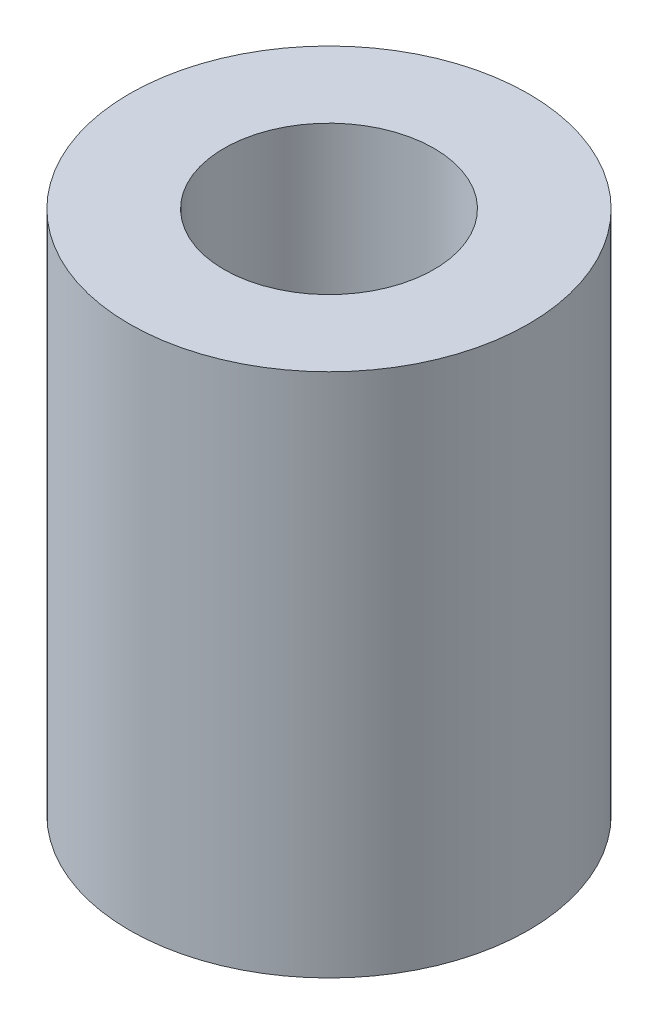
from build123d import *

# Parameters (mm, degrees)
SKETCH1_R           = 9.5
BOSS_EXTRUDE1_DEPTH = 25
SKETCH2_R           = 5
CUT_EXTRUDE1_DEPTH  = 20
SKETCH3_R           = 2
CUT_EXTRUDE2_DEPTH  = 29.381331893


with BuildPart() as part:
    # Sketch1 → Boss-Extrude1 (new body)
    with BuildSketch(Plane(origin=(0, 0, 0), x_dir=(1, 0, 0), z_dir=(0, 1, 0))):
        with Locations(Location((0, 0, 0), (0, 0, 270))):
            Circle(SKETCH1_R)
    extrude(amount=BOSS_EXTRUDE1_DEPTH)

    # Sketch2 → Cut-Extrude1 (cut)
    with BuildSketch(Plane(origin=(0, 25, 0), x_dir=(1, 0, 0), z_dir=(0, 1, 0))):
        with Locations(Location((0, 0, 0), (0, 0, 270))):
            Circle(SKETCH2_R)
    extrude(amount=-CUT_EXTRUDE1_DEPTH, mode=Mode.SUBTRACT)

    # Sketch3 → Cut-Extrude2 (cut, through all)
    with BuildSketch(Plane.XZ):
        with Locations(Location((0, 0, 0), (0, 0, 270))):
            Circle(SKETCH3_R)
    extrude(amount=-CUT_EXTRUDE2_DEPTH, mode=Mode.SUBTRACT)


solid = part.part
